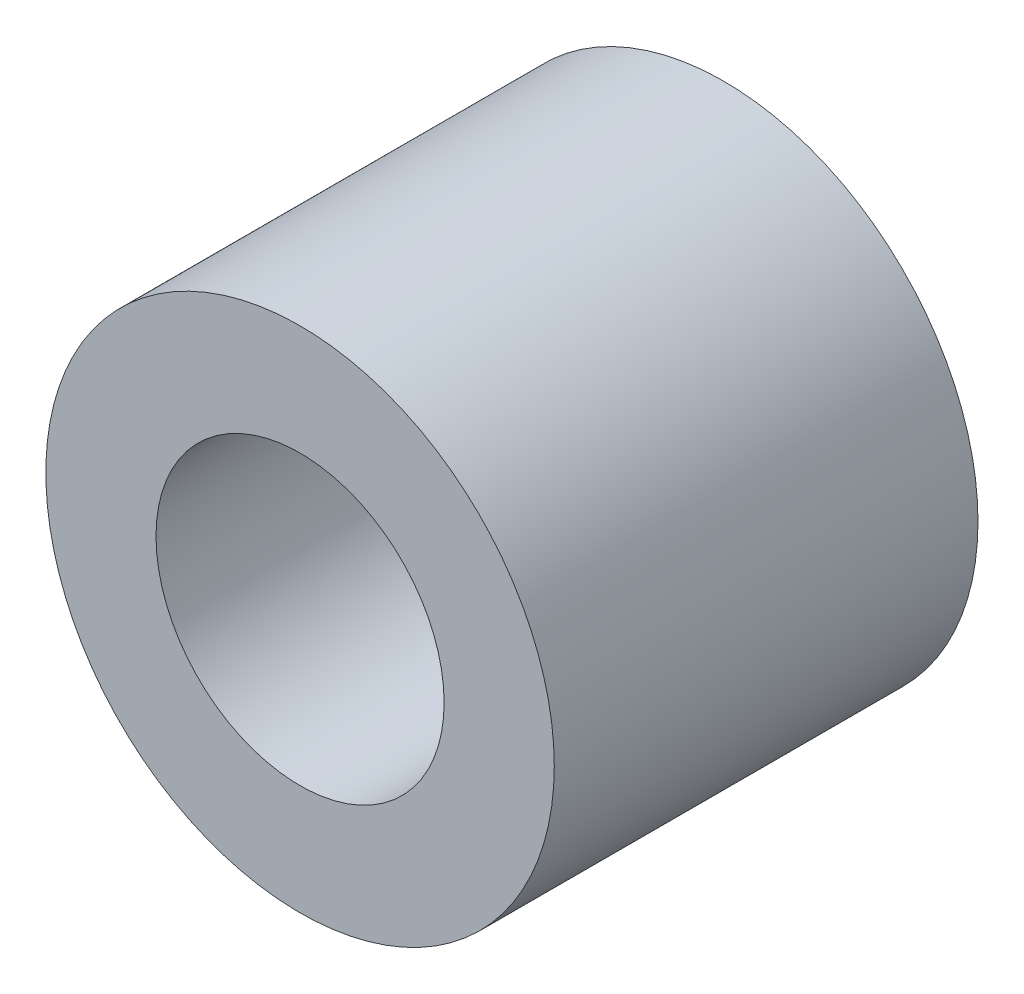
from build123d import *

# Parameters (mm, degrees)
SKETCH1_R           = 3
SKETCH1_R_2         = 1.7
BOSS_EXTRUDE1_DEPTH = 5


with BuildPart() as part:
    # Sketch1 → Boss-Extrude1 (new body)
    with BuildSketch(Plane.XY):
        Circle(SKETCH1_R)
        Circle(SKETCH1_R_2, mode=Mode.SUBTRACT)
    extrude(amount=-BOSS_EXTRUDE1_DEPTH)


solid = part.part
